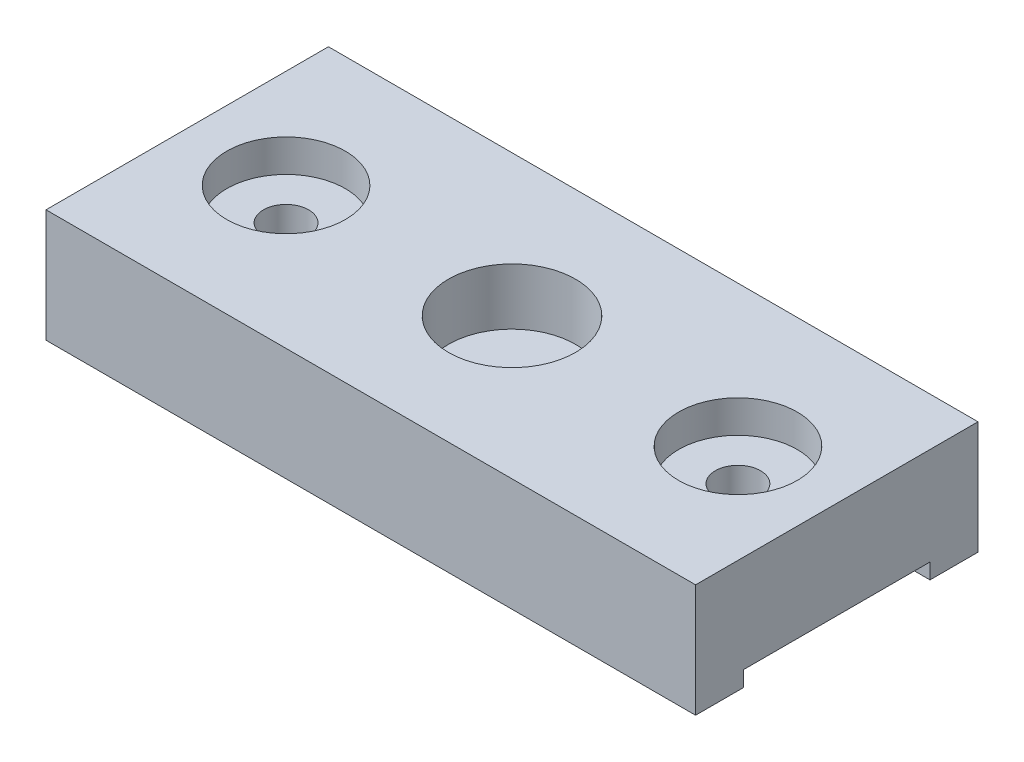
from build123d import *

# Parameters (mm, degrees)
SKETCH1_W                                        = 46
SKETCH1_H                                        = 20
BOSS_EXTRUDE1_DEPTH                              = 8
SKETCH3_R                                        = 4.5
CUT_EXTRUDE2_DEPTH                               = 4
CUT_EXTRUDE3_REACH                               = 49.749
CBORE_FOR_M3_HEX_HEAD_MACHINE_SCREW1_D           = 3.2
CBORE_FOR_M3_HEX_HEAD_MACHINE_SCREW1_CBORE_D     = 8.4
CBORE_FOR_M3_HEX_HEAD_MACHINE_SCREW1_CBORE_DEPTH = 2.3


with BuildPart() as part:
    # Sketch1 → Boss-Extrude1 (new body)
    with BuildSketch(Plane(origin=(0, 0, 0), x_dir=(1, 0, 0), z_dir=(0, 1, 0))):
        Rectangle(SKETCH1_W, SKETCH1_H)
    extrude(amount=BOSS_EXTRUDE1_DEPTH)

    # Sketch3 → Cut-Extrude2 (cut)
    with BuildSketch(Plane(origin=(0, 8, 0), x_dir=(1, 0, 0), z_dir=(0, 1, 0))):
        with Locations(Location((0, 0, 0), (0, 0, 270))):
            Circle(SKETCH3_R)
    extrude(amount=-CUT_EXTRUDE2_DEPTH, mode=Mode.SUBTRACT)

    # Sketch8 → Cut-Extrude3 (cut, up to next)
    with BuildSketch(Plane.ZY.offset(23), mode=Mode.PRIVATE) as cut_extrude3_sk1:
        Polygon((0, 0), (-6.6, 0), (-6.6, 1.1), (6.6, 1.1), (6.6, 0), align=None)
    cut_extrude3_tool1 = extrude(cut_extrude3_sk1.sketch, amount=-CUT_EXTRUDE3_REACH, mode=Mode.PRIVATE) & part.part
    add(cut_extrude3_tool1.solids().sort_by_distance((-23, 0.55, 0))[0], mode=Mode.SUBTRACT)

    # CBORE for M3 Hex Head Machine Screw1 (through all)
    with Locations(Plane(origin=(0, 8, 0), x_dir=(1, 0, 0), z_dir=(0, 1, 0))):
        with Locations((-16, 0), (16, 0)):
            CounterBoreHole(CBORE_FOR_M3_HEX_HEAD_MACHINE_SCREW1_D / 2, CBORE_FOR_M3_HEX_HEAD_MACHINE_SCREW1_CBORE_D / 2, CBORE_FOR_M3_HEX_HEAD_MACHINE_SCREW1_CBORE_DEPTH)


solid = part.part
